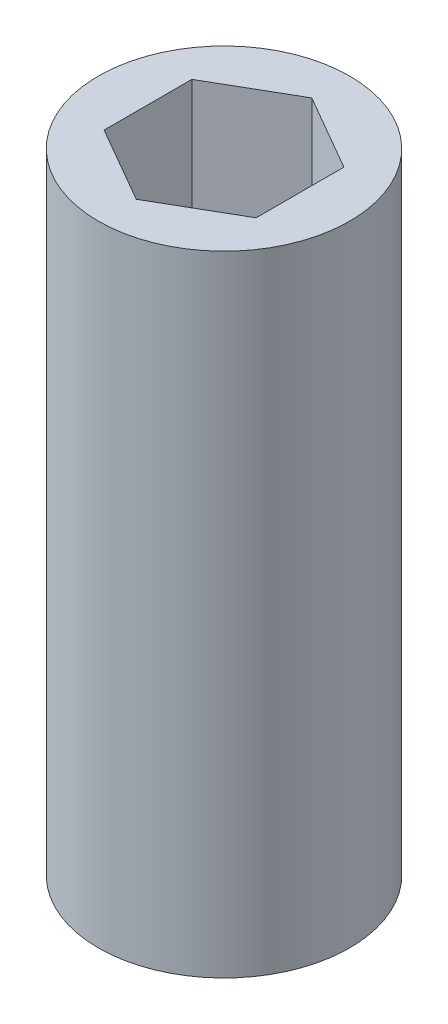
from build123d import *

# Parameters (mm, degrees)
SKETCH1_R           = 7.9375
BOSS_EXTRUDE1_DEPTH = 39.751


with BuildPart() as part:
    # Sketch1 → Boss-Extrude1 (new body)
    with BuildSketch(Plane(origin=(0, 0, 0), x_dir=(1, 0, 0), z_dir=(0, 1, 0))):
        with Locations(Location((0, 0, 0), (0, 0, 270))):
            Circle(SKETCH1_R)
        Polygon((0, 5.543255405), (-4.8006, 2.771627702), (-4.8006, -2.771627702), (0, -5.543255405), (4.8006, -2.771627702), (4.8006, 2.771627702), align=None, mode=Mode.SUBTRACT)
    extrude(amount=BOSS_EXTRUDE1_DEPTH)


solid = part.part
